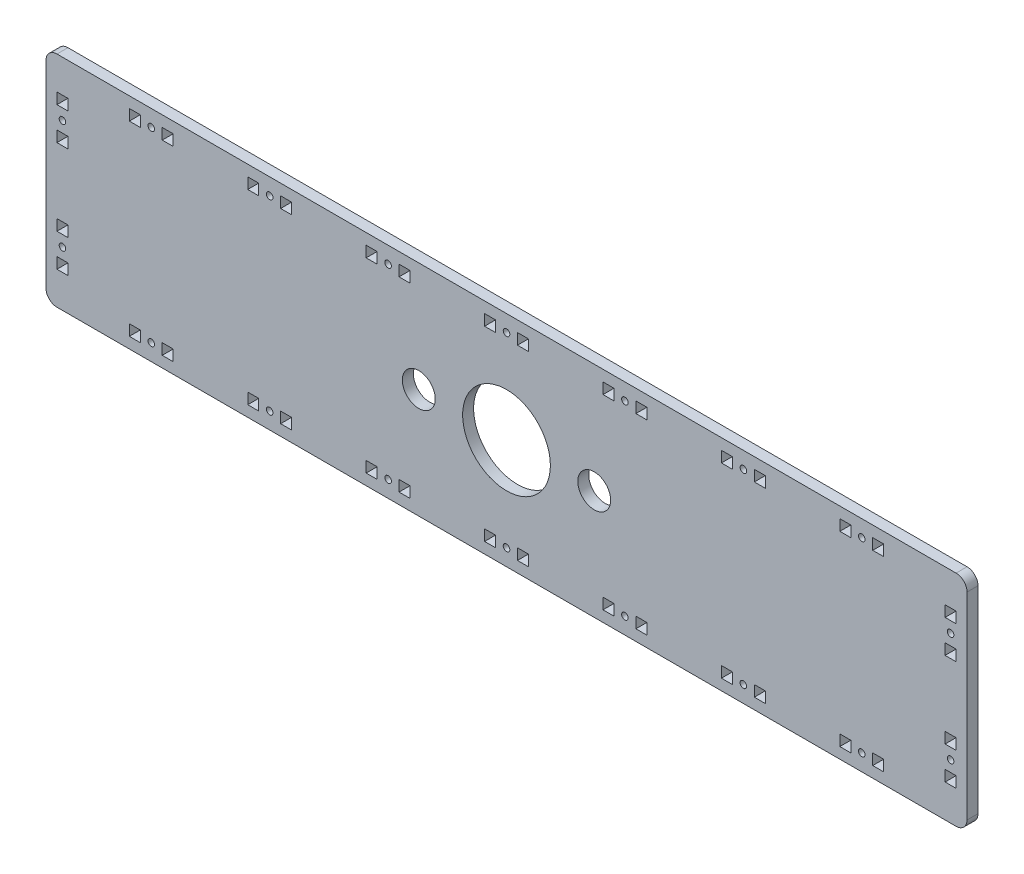
from build123d import *

# Parameters (mm, degrees)
SKETCH1_W           = 420
SKETCH1_H           = 100
SKETCH1_R           = 20
SKETCH1_R_2         = 7.5
SKETCH1_R_3         = 1.5
SKETCH1_W_2         = 5
SKETCH1_H_2         = 5
BOSS_EXTRUDE1_DEPTH = 5
FILLET1_R           = 5


with BuildPart() as part:
    # Sketch1 → Boss-Extrude1 (new body)
    with BuildSketch(Plane.XY):
        Rectangle(SKETCH1_W, SKETCH1_H)
        Circle(SKETCH1_R, mode=Mode.SUBTRACT)
        with Locations((-40, 0)):
            Circle(SKETCH1_R_2, mode=Mode.SUBTRACT)
        with Locations(Location((40, 0, 0), (0, 0, 180))):
            Circle(SKETCH1_R_2, mode=Mode.SUBTRACT)
        with Locations((0, -42.5)):
            Circle(SKETCH1_R_3, mode=Mode.SUBTRACT)
        with Locations((-54, -42.5)):
            Circle(SKETCH1_R_3, mode=Mode.SUBTRACT)
        with Locations((-108, -42.5)):
            Circle(SKETCH1_R_3, mode=Mode.SUBTRACT)
        with Locations((-162, -42.5)):
            Circle(SKETCH1_R_3, mode=Mode.SUBTRACT)
        with Locations((-202.5, 25)):
            Circle(SKETCH1_R_3, mode=Mode.SUBTRACT)
        with Locations(Location((54, -42.5, 0), (0, 0, 180))):
            Circle(SKETCH1_R_3, mode=Mode.SUBTRACT)
        with Locations(Location((108, -42.5, 0), (0, 0, 180))):
            Circle(SKETCH1_R_3, mode=Mode.SUBTRACT)
        with Locations(Location((162, -42.5, 0), (0, 0, 180))):
            Circle(SKETCH1_R_3, mode=Mode.SUBTRACT)
        with Locations(Location((-54, 42.5, 0), (0, 0, 90))):
            Circle(SKETCH1_R_3, mode=Mode.SUBTRACT)
        with Locations((162, 42.5)):
            Circle(SKETCH1_R_3, mode=Mode.SUBTRACT)
        with Locations(Location((-108, 42.5, 0), (0, 0, 90))):
            Circle(SKETCH1_R_3, mode=Mode.SUBTRACT)
        with Locations(Location((0, 42.5, 0), (0, 0, 90))):
            Circle(SKETCH1_R_3, mode=Mode.SUBTRACT)
        with Locations(Location((-162, 42.5, 0), (0, 0, 90))):
            Circle(SKETCH1_R_3, mode=Mode.SUBTRACT)
        with Locations((54, 42.5)):
            Circle(SKETCH1_R_3, mode=Mode.SUBTRACT)
        with Locations((108, 42.5)):
            Circle(SKETCH1_R_3, mode=Mode.SUBTRACT)
        with Locations(Location((-202.5, -25, 0), (0, 0, 90))):
            Circle(SKETCH1_R_3, mode=Mode.SUBTRACT)
        with Locations(Location((202.5, 25, 0), (0, 0, 180))):
            Circle(SKETCH1_R_3, mode=Mode.SUBTRACT)
        with Locations((202.5, -25)):
            Circle(SKETCH1_R_3, mode=Mode.SUBTRACT)
        with Locations((-7.5, -42.5)):
            Rectangle(SKETCH1_W_2, SKETCH1_H_2, mode=Mode.SUBTRACT)
        with Locations((7.5, -42.5)):
            Rectangle(SKETCH1_W_2, SKETCH1_H_2, mode=Mode.SUBTRACT)
        with Locations((-61.5, -42.5)):
            Rectangle(SKETCH1_W_2, SKETCH1_H_2, mode=Mode.SUBTRACT)
        with Locations((-46.5, -42.5)):
            Rectangle(SKETCH1_W_2, SKETCH1_H_2, mode=Mode.SUBTRACT)
        with Locations((-115.5, -42.5)):
            Rectangle(SKETCH1_W_2, SKETCH1_H_2, mode=Mode.SUBTRACT)
        with Locations((-100.5, -42.5)):
            Rectangle(SKETCH1_W_2, SKETCH1_H_2, mode=Mode.SUBTRACT)
        with Locations((-169.5, -42.5)):
            Rectangle(SKETCH1_W_2, SKETCH1_H_2, mode=Mode.SUBTRACT)
        with Locations((-154.5, -42.5)):
            Rectangle(SKETCH1_W_2, SKETCH1_H_2, mode=Mode.SUBTRACT)
        with Locations((-202.5, 17.5)):
            Rectangle(SKETCH1_W_2, SKETCH1_H_2, mode=Mode.SUBTRACT)
        with Locations((-202.5, 32.5)):
            Rectangle(SKETCH1_W_2, SKETCH1_H_2, mode=Mode.SUBTRACT)
        with Locations((61.5, -42.5)):
            Rectangle(SKETCH1_W_2, SKETCH1_H_2, mode=Mode.SUBTRACT)
        with Locations((46.5, -42.5)):
            Rectangle(SKETCH1_W_2, SKETCH1_H_2, mode=Mode.SUBTRACT)
        with Locations((115.5, -42.5)):
            Rectangle(SKETCH1_W_2, SKETCH1_H_2, mode=Mode.SUBTRACT)
        with Locations((100.5, -42.5)):
            Rectangle(SKETCH1_W_2, SKETCH1_H_2, mode=Mode.SUBTRACT)
        with Locations((169.5, -42.5)):
            Rectangle(SKETCH1_W_2, SKETCH1_H_2, mode=Mode.SUBTRACT)
        with Locations((154.5, -42.5)):
            Rectangle(SKETCH1_W_2, SKETCH1_H_2, mode=Mode.SUBTRACT)
        with Locations((-61.5, 42.5)):
            Rectangle(SKETCH1_W_2, SKETCH1_H_2, mode=Mode.SUBTRACT)
        with Locations((-46.5, 42.5)):
            Rectangle(SKETCH1_W_2, SKETCH1_H_2, mode=Mode.SUBTRACT)
        with Locations((169.5, 42.5)):
            Rectangle(SKETCH1_W_2, SKETCH1_H_2, mode=Mode.SUBTRACT)
        with Locations((154.5, 42.5)):
            Rectangle(SKETCH1_W_2, SKETCH1_H_2, mode=Mode.SUBTRACT)
        with Locations((-115.5, 42.5)):
            Rectangle(SKETCH1_W_2, SKETCH1_H_2, mode=Mode.SUBTRACT)
        with Locations((-100.5, 42.5)):
            Rectangle(SKETCH1_W_2, SKETCH1_H_2, mode=Mode.SUBTRACT)
        with Locations((-7.5, 42.5)):
            Rectangle(SKETCH1_W_2, SKETCH1_H_2, mode=Mode.SUBTRACT)
        with Locations((7.5, 42.5)):
            Rectangle(SKETCH1_W_2, SKETCH1_H_2, mode=Mode.SUBTRACT)
        with Locations((-169.5, 42.5)):
            Rectangle(SKETCH1_W_2, SKETCH1_H_2, mode=Mode.SUBTRACT)
        with Locations((-154.5, 42.5)):
            Rectangle(SKETCH1_W_2, SKETCH1_H_2, mode=Mode.SUBTRACT)
        with Locations((61.5, 42.5)):
            Rectangle(SKETCH1_W_2, SKETCH1_H_2, mode=Mode.SUBTRACT)
        with Locations((46.5, 42.5)):
            Rectangle(SKETCH1_W_2, SKETCH1_H_2, mode=Mode.SUBTRACT)
        with Locations((115.5, 42.5)):
            Rectangle(SKETCH1_W_2, SKETCH1_H_2, mode=Mode.SUBTRACT)
        with Locations((100.5, 42.5)):
            Rectangle(SKETCH1_W_2, SKETCH1_H_2, mode=Mode.SUBTRACT)
        with Locations((-202.5, -17.5)):
            Rectangle(SKETCH1_W_2, SKETCH1_H_2, mode=Mode.SUBTRACT)
        with Locations((-202.5, -32.5)):
            Rectangle(SKETCH1_W_2, SKETCH1_H_2, mode=Mode.SUBTRACT)
        with Locations((202.5, 17.5)):
            Rectangle(SKETCH1_W_2, SKETCH1_H_2, mode=Mode.SUBTRACT)
        with Locations((202.5, 32.5)):
            Rectangle(SKETCH1_W_2, SKETCH1_H_2, mode=Mode.SUBTRACT)
        with Locations((202.5, -17.5)):
            Rectangle(SKETCH1_W_2, SKETCH1_H_2, mode=Mode.SUBTRACT)
        with Locations((202.5, -32.5)):
            Rectangle(SKETCH1_W_2, SKETCH1_H_2, mode=Mode.SUBTRACT)
    extrude(amount=BOSS_EXTRUDE1_DEPTH)

    # Fillet1
    fillet1_edges = [part.edges().sort_by_distance(p)[0] for p in [
        (210, -50, 2.5),
        (-210, -50, 2.5),
        (-210, 50, 2.5),
        (210, 50, 2.5),
    ]]
    fillet(fillet1_edges, radius=FILLET1_R)


solid = part.part
